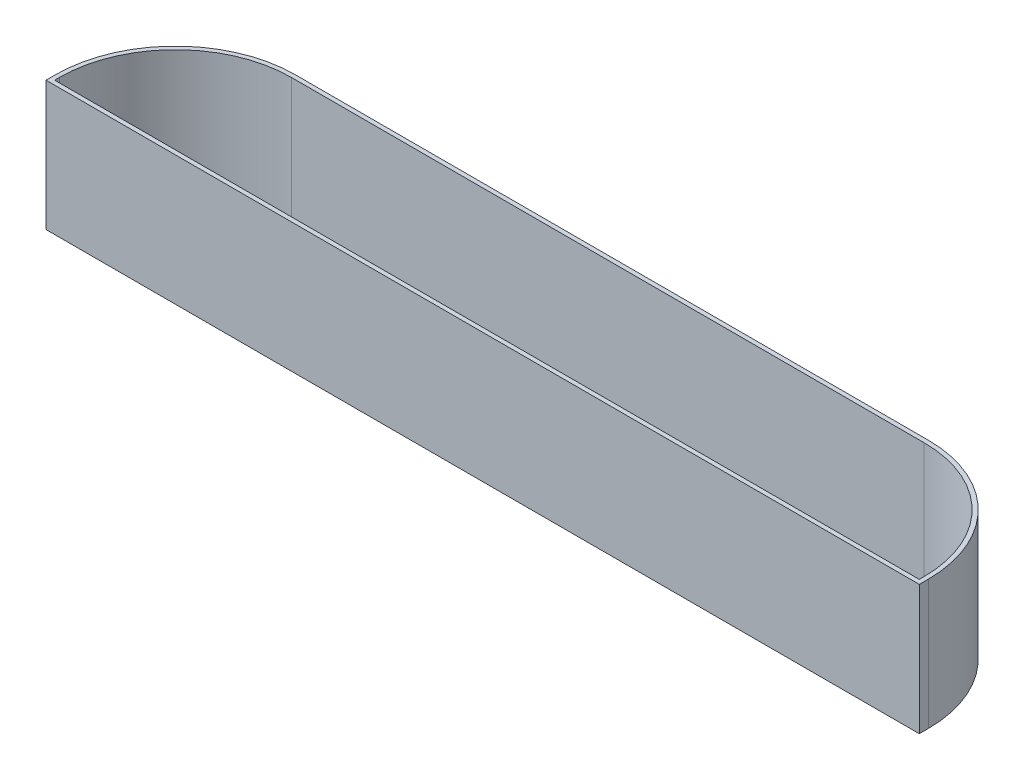
from build123d import *

# Parameters (mm, degrees)
BOSS_EXTRUDE1_DEPTH = 76.2


with BuildPart() as part:
    # Sketch1 → Boss-Extrude1 (new body)
    with BuildSketch(Plane(origin=(0, 0, 0), x_dir=(1, 0, 0), z_dir=(0, 1, 0))):
        with BuildLine():
            Line((-257.175, 0), (257.175, 0))
            Line((257.175, 0), (257.175, 5.4))
            ThreePointArc((257.175, 5.4), (236.438160108, 55.463160108), (186.375, 76.2))
            Line((186.375, 76.2), (-186.375, 76.2))
            ThreePointArc((-186.375, 76.2), (-236.438160108, 55.463160108), (-257.175, 5.4))
            Line((-257.175, 5.4), (-257.175, 0))
        make_face()
        with BuildLine():
            Line((254.635, 5.4), (254.635, 2.54))
            Line((254.635, 2.54), (-254.635, 2.54))
            Line((-254.635, 2.54), (-254.635, 5.4))
            ThreePointArc((-254.635, 5.4), (-234.642108884, 53.667108884), (-186.375, 73.66))
            Line((-186.375, 73.66), (186.375, 73.66))
            ThreePointArc((186.375, 73.66), (234.642108884, 53.667108884), (254.635, 5.4))
        make_face(mode=Mode.SUBTRACT)
    extrude(amount=BOSS_EXTRUDE1_DEPTH)


solid = part.part
